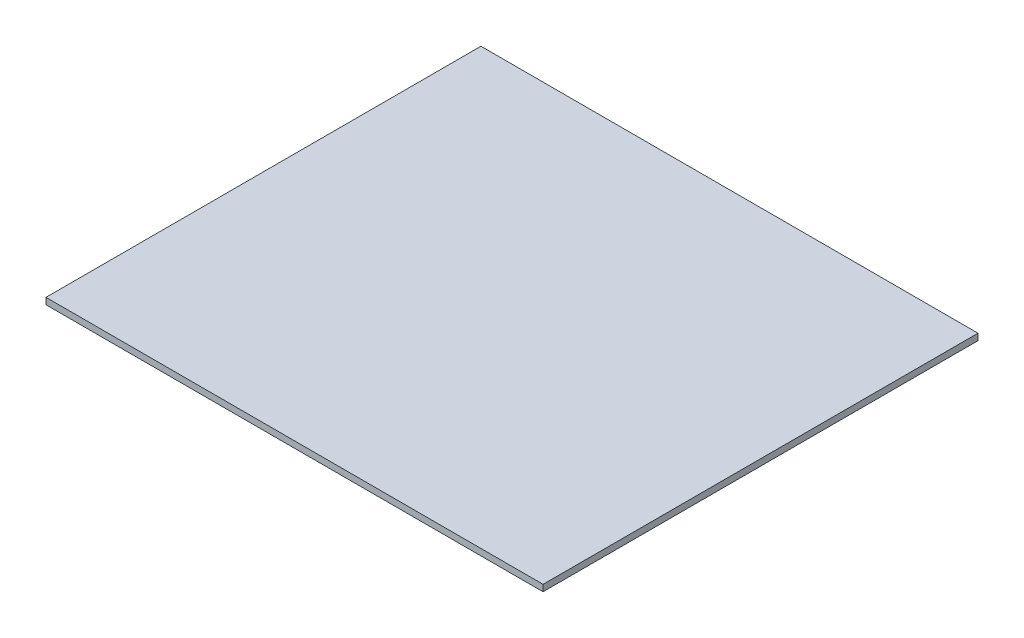
from build123d import *

# Parameters (mm, degrees)
SZKIC1_W                    = 1430
SZKIC1_H                    = 750
DODANIE_WYCI_GNI_CIE1_DEPTH = 10.4
SZKIC3_W                    = 1754.949299291
SZKIC3_H                    = 1075.566752827
SZKIC3_W_2                  = 800
SZKIC3_H_2                  = 700
WYTNIJ_WYCI_GNI_CIE2_DEPTH  = 200


with BuildPart() as part:
    # Szkic1 → Dodanie-wyciągnięcie1 (new body)
    with BuildSketch(Plane(origin=(0, 0, 0), x_dir=(1, 0, 0), z_dir=(0, 1, 0))):
        Rectangle(SZKIC1_W, SZKIC1_H)
    extrude(amount=DODANIE_WYCI_GNI_CIE1_DEPTH)

    # Szkic3 → Wytnij-wyciągnięcie2 (cut)
    with BuildSketch(Plane(origin=(0, 10.4, 0), x_dir=(1, 0, 0), z_dir=(0, 1, 0))):
        with Locations((-1.467348912, 2.201023369)):
            Rectangle(SZKIC3_W, SZKIC3_H)
        with Locations((-315, -25)):
            Rectangle(SZKIC3_W_2, SZKIC3_H_2, mode=Mode.SUBTRACT)
    extrude(amount=-WYTNIJ_WYCI_GNI_CIE2_DEPTH, mode=Mode.SUBTRACT)


solid = part.part
